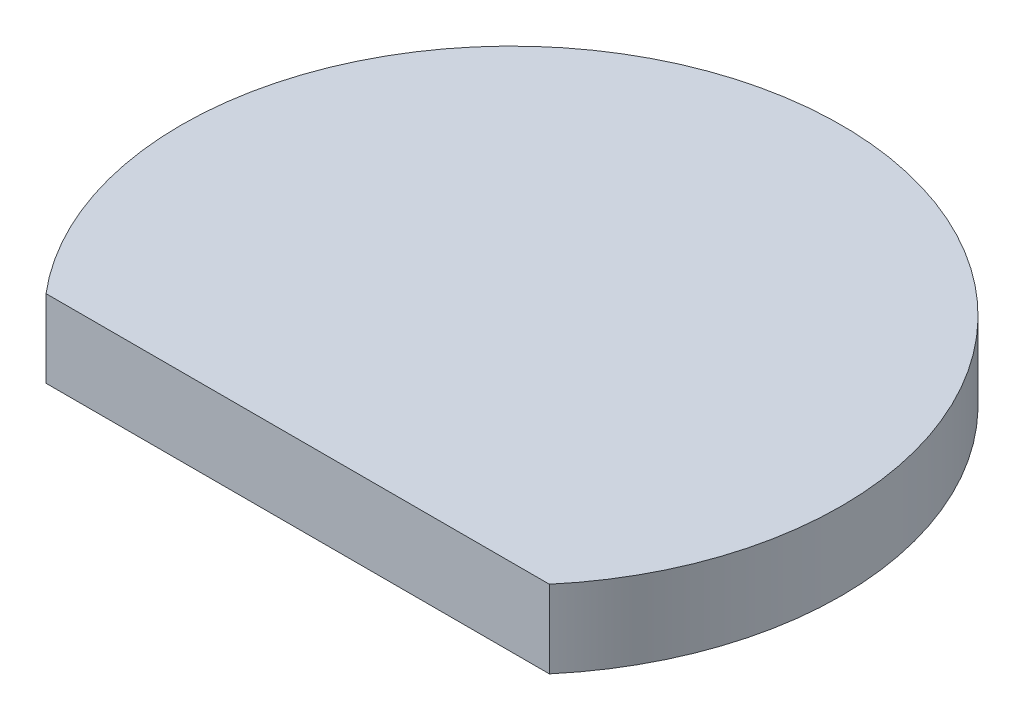
from build123d import *

# Parameters (mm, degrees)
DODANIE_WYCI_GNI_CIE1_DEPTH = 2


with BuildPart() as part:
    # Szkic1 → Dodanie-wyciągnięcie1 (new body)
    with BuildSketch(Plane(origin=(0, 0, 0), x_dir=(1, 0, 0), z_dir=(0, 1, 0))):
        with BuildLine():
            Line((-6.480740698, -5.5), (6.480740698, -5.5))
            ThreePointArc((6.480740698, -5.5), (0, 8.5), (-6.480740698, -5.5))
        make_face()
    extrude(amount=DODANIE_WYCI_GNI_CIE1_DEPTH)


solid = part.part
